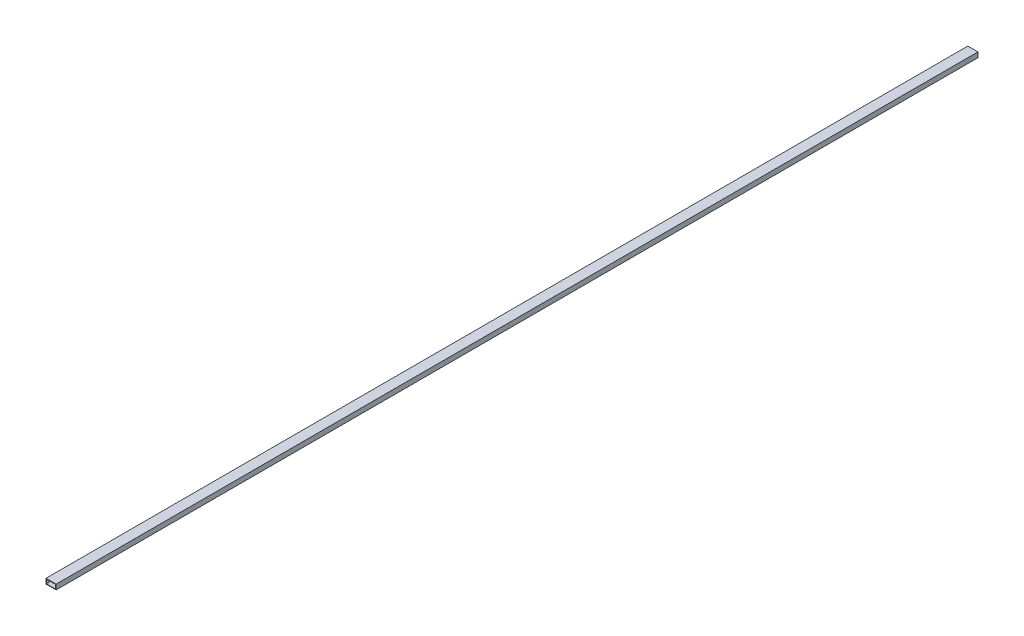
from build123d import *

# Parameters (mm, degrees)
SKETCH_1_W      = 20
SKETCH_1_H      = 10
SKETCH_1_W_2    = 18
SKETCH_1_H_2    = 8
EXTRUDE_1_DEPTH = 1820


with BuildPart() as part:
    # 草图1 → 凸台-拉伸1 (new body)
    with BuildSketch(Plane.XY):
        with Locations((10, 5)):
            Rectangle(SKETCH_1_W, SKETCH_1_H)
        with Locations((10, 5)):
            Rectangle(SKETCH_1_W_2, SKETCH_1_H_2, mode=Mode.SUBTRACT)
    extrude(amount=EXTRUDE_1_DEPTH)


solid = part.part
